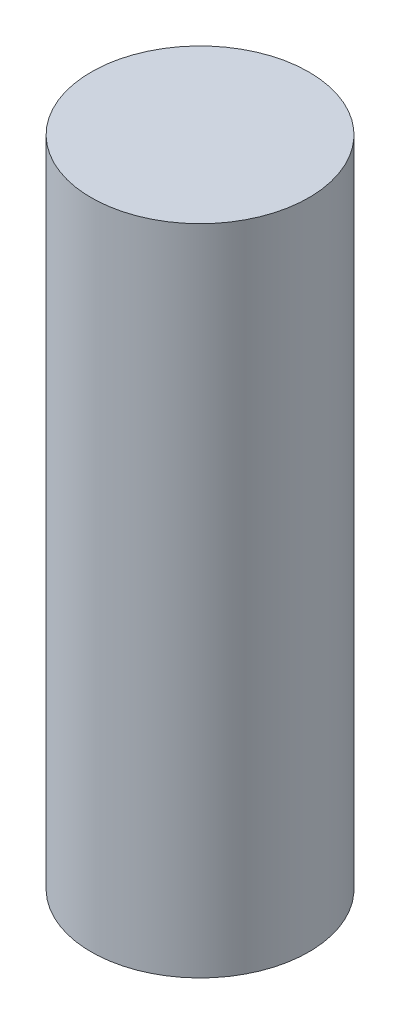
from build123d import *

# Parameters (mm, degrees)
SKETCH1_R           = 3.175
BOSS_EXTRUDE1_DEPTH = 19.05


with BuildPart() as part:
    # Sketch1 → Boss-Extrude1 (new body)
    with BuildSketch(Plane(origin=(0, 0, 0), x_dir=(1, 0, 0), z_dir=(0, 1, 0))):
        with Locations(Location((0, 0, 0), (0, 0, 90))):
            Circle(SKETCH1_R)
    extrude(amount=BOSS_EXTRUDE1_DEPTH)


solid = part.part
